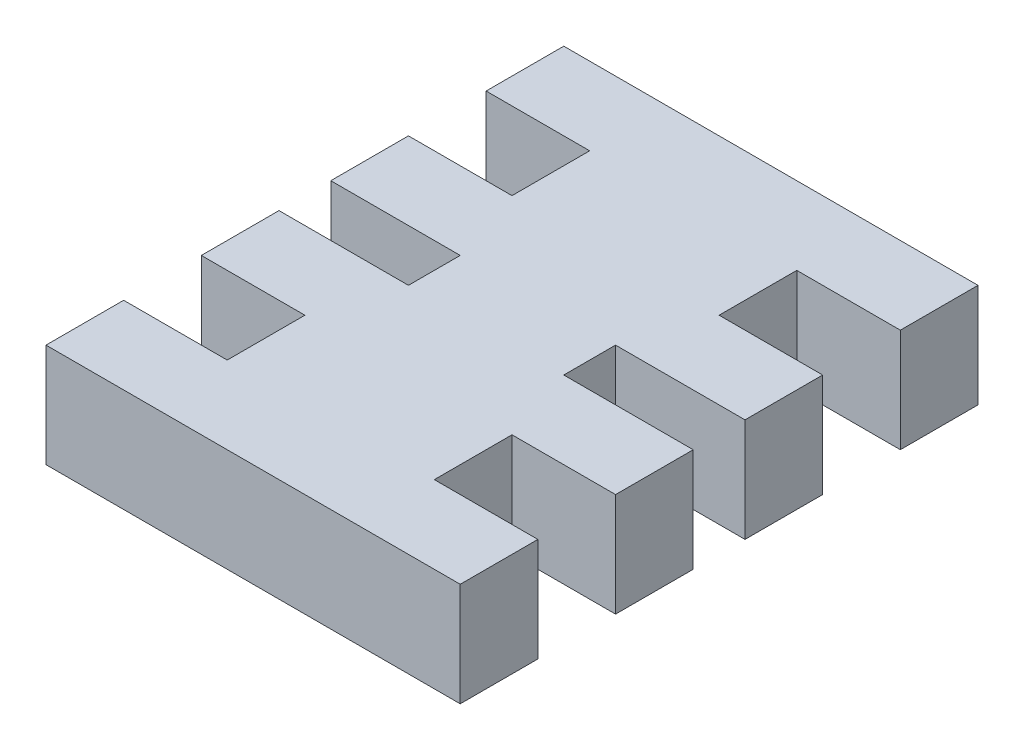
from build123d import *

# Parameters (mm, degrees)
BOSS_EXTRUDE1_DEPTH = 20


with BuildPart() as part:
    # Sketch1 → Boss-Extrude1 (new body)
    with BuildSketch(Plane(origin=(0, 0, 0), x_dir=(1, 0, 0), z_dir=(0, 1, 0))):
        Polygon((-40, 50), (40, 50), (40, 35), (20, 35), (20, 20), (40, 20), (40, 5), (15, 5), (15, -5), (40, -5), (40, -20), (20, -20), (20, -35), (40, -35), (40, -50), (-40, -50), (-40, -35), (-20, -35), (-20, -20), (-40, -20), (-40, -5), (-15, -5), (-15, 5), (-40, 5), (-40, 20), (-20, 20), (-20, 35), (-40, 35), align=None)
    extrude(amount=BOSS_EXTRUDE1_DEPTH)


solid = part.part
